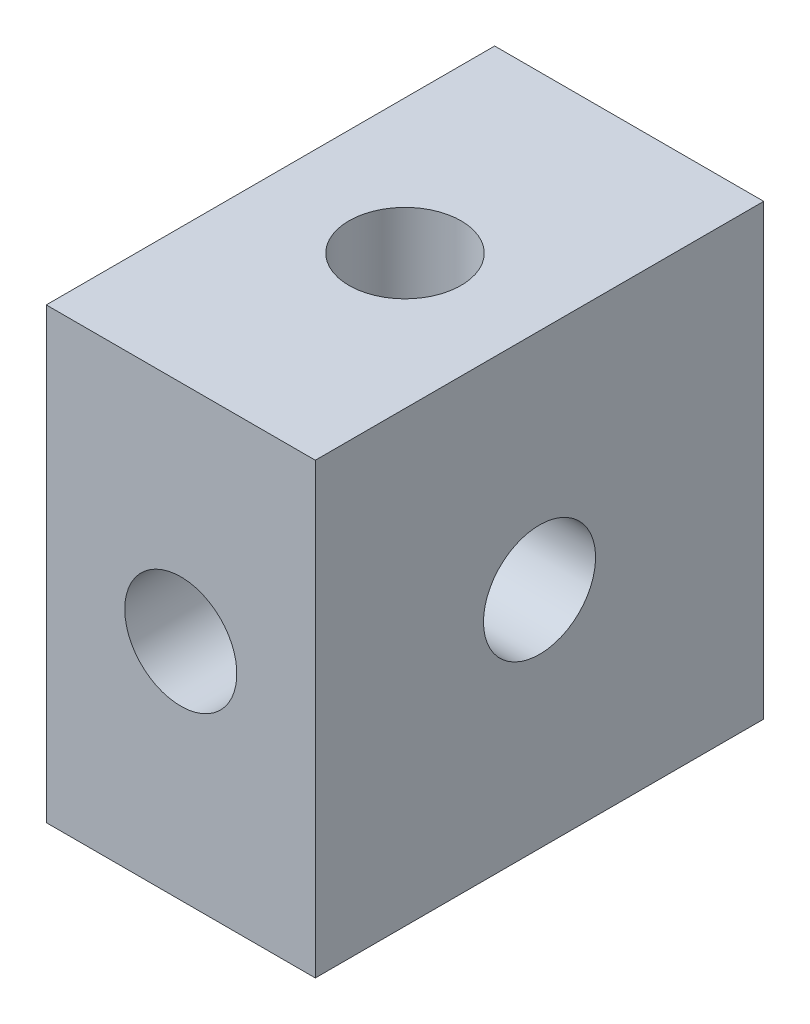
from build123d import *

# Parameters (mm, degrees)
SKETCH_1_W          = 6
SKETCH_1_H          = 10
EXTRUDE_1_DEPTH     = 10
SKETCH_2_R          = 1.25
CUT_EXTRUDE_1_DEPTH = 15.456832295
SKETCH_3_R          = 1.25
CUT_EXTRUDE_2_DEPTH = 12.575836903
SKETCH_5_R          = 1.25
CUT_EXTRUDE_3_DEPTH = 13.68857754


with BuildPart() as part:
    # 草图1 → 凸台-拉伸1 (new body)
    with BuildSketch(Plane.XY):
        Rectangle(SKETCH_1_W, SKETCH_1_H)
    extrude(amount=EXTRUDE_1_DEPTH)

    # 草图2 → 切除-拉伸1 (cut, through all)
    with BuildSketch(Plane(origin=(0, 5, 0), x_dir=(1, 0, 0), z_dir=(0, 1, 0))):
        with Locations(Location((0, -5, 0), (0, 0, 180))):
            Circle(SKETCH_2_R)
    extrude(amount=-CUT_EXTRUDE_1_DEPTH, mode=Mode.SUBTRACT)

    # 草图3 → 切除-拉伸2 (cut, through all)
    with BuildSketch(Plane(origin=(0, 0, 0), x_dir=(-1, 0, 0), z_dir=(0, 0, -1))):
        Circle(SKETCH_3_R)
    extrude(amount=-CUT_EXTRUDE_2_DEPTH, mode=Mode.SUBTRACT)

    # 草图5 → 切除-拉伸3 (cut, through all)
    with BuildSketch(Plane.ZY.offset(3)):
        with Locations((5, 0)):
            Circle(SKETCH_5_R)
    extrude(amount=-CUT_EXTRUDE_3_DEPTH, mode=Mode.SUBTRACT)


solid = part.part
